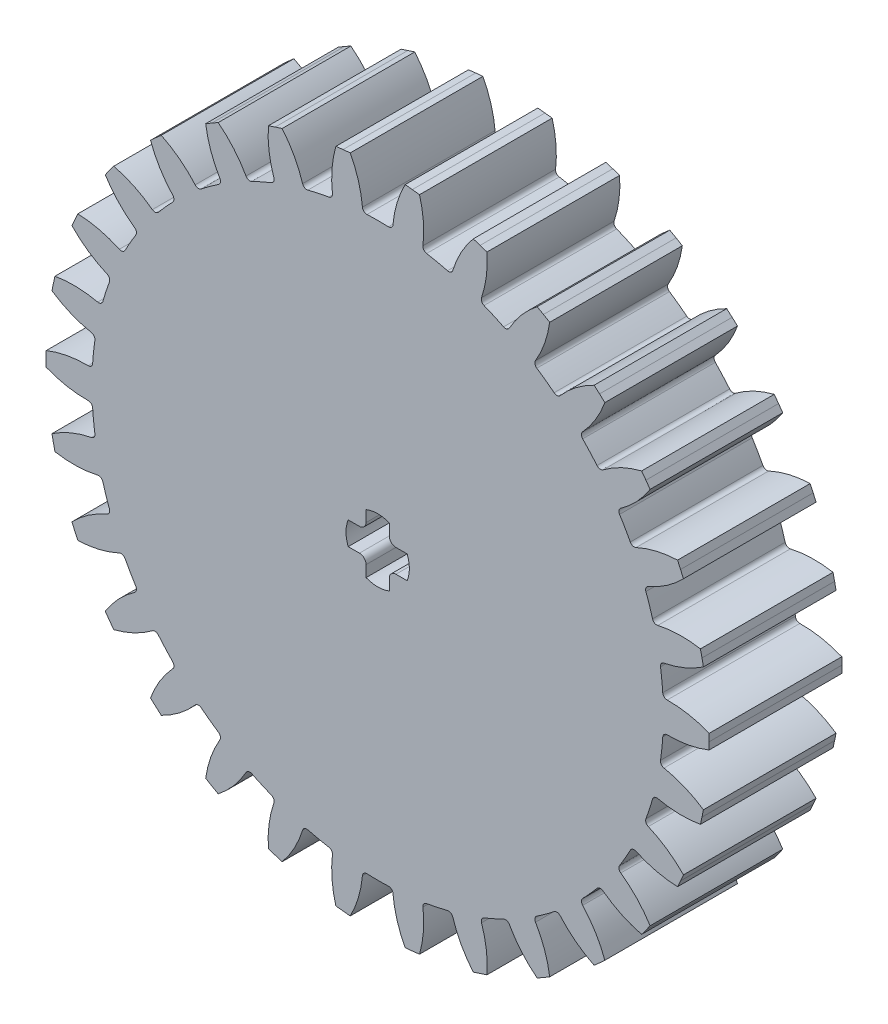
from build123d import *

# Parameters (mm, degrees)
BOSS_EXTRUDE1_DEPTH      = 10
FILLET1_R                = 0.3325
CIRPATTERN1_COUNT        = 30
FILLET1_OF_CIRPATTERN1_R = 0.3325
CUT_EXTRUDE1_REACH       = 38.684


with BuildPart() as part:
    # Sketch1 → Boss-Extrude1 (new body)
    with BuildSketch(Plane.XY):
        with BuildLine():
            Line((24.994050677, 0.545372126), (25, 0))
            Line((25, 0), (24.994050677, -0.545372126))
            ThreePointArc((24.994050677, -0.545372126), (23.285368719, -1.026917112), (21.512976752, -1.127447337))
            ThreePointArc((21.512976752, -1.127447337), (21.476091662, -1.69020507), (21.424487931, -2.25180442))
            Line((21.424487931, -2.25180442), (0, 0))
            Line((0, 0), (21.424487931, 2.25180442))
            ThreePointArc((21.424487931, 2.25180442), (21.476091662, 1.69020507), (21.512976752, 1.127447337))
            ThreePointArc((21.512976752, 1.127447337), (23.285368719, 1.026917112), (24.994050677, 0.545372126))
        make_face()
    boss_extrude1 = extrude(amount=BOSS_EXTRUDE1_DEPTH)

    # Fillet1
    fillet1_edges = [part.edges().sort_by_distance(p)[0] for p in [
        (21.512976752, 1.127447337, 5),
        (21.512976752, -1.127447337, 5),
    ]]
    fillet(fillet1_edges, radius=FILLET1_R)

    # CirPattern1: Boss-Extrude1 ×30 about axis
    cirpattern1_axis = Axis((0, 0, 0), (0, 0, 1))
    for i in range(1, CIRPATTERN1_COUNT):
        add(boss_extrude1.rotate(cirpattern1_axis, i * 360 / CIRPATTERN1_COUNT))

    # Fillet1 of CirPattern1
    fillet1_of_cirpattern1_edges = [part.edges().sort_by_distance(p)[0] for p in [
        (20.808457113, 5.575609279, 5),
        (21.277276077, 3.369989463, 5),
        (19.194508047, 9.780090341, 5),
        (20.111656338, 7.720141553, 5),
        (16.741666875, 13.557134524, 5),
        (18.06706071, 11.732886412, 5),
        (13.557134524, 16.741666875, 5),
        (15.232847834, 15.232847834, 5),
        (9.780090341, 19.194508047, 5),
        (11.732886412, 18.06706071, 5),
        (5.575609279, 20.808457113, 5),
        (7.720141553, 20.111656338, 5),
        (1.127447337, 21.512976752, 5),
        (3.369989463, 21.277276077, 5),
        (-3.369989463, 21.277276077, 5),
        (-1.127447337, 21.512976752, 5),
        (-7.720141553, 20.111656338, 5),
        (-5.575609279, 20.808457113, 5),
        (-11.732886412, 18.06706071, 5),
        (-9.780090341, 19.194508047, 5),
        (-15.232847834, 15.232847834, 5),
        (-13.557134524, 16.741666875, 5),
        (-18.06706071, 11.732886412, 5),
        (-16.741666875, 13.557134524, 5),
        (-20.111656338, 7.720141553, 5),
        (-19.194508047, 9.780090341, 5),
        (-21.277276077, 3.369989463, 5),
        (-20.808457113, 5.575609279, 5),
        (-21.512976752, -1.127447337, 5),
        (-21.512976752, 1.127447337, 5),
        (-20.808457113, -5.575609279, 5),
        (-21.277276077, -3.369989463, 5),
        (-19.194508047, -9.780090341, 5),
        (-20.111656338, -7.720141553, 5),
        (-16.741666875, -13.557134524, 5),
        (-18.06706071, -11.732886412, 5),
        (-13.557134524, -16.741666875, 5),
        (-15.232847834, -15.232847834, 5),
        (-9.780090341, -19.194508047, 5),
        (-11.732886412, -18.06706071, 5),
        (-5.575609279, -20.808457113, 5),
        (-7.720141553, -20.111656338, 5),
        (-1.127447337, -21.512976752, 5),
        (-3.369989463, -21.277276077, 5),
        (3.369989463, -21.277276077, 5),
        (1.127447337, -21.512976752, 5),
        (7.720141553, -20.111656338, 5),
        (5.575609279, -20.808457113, 5),
        (11.732886412, -18.06706071, 5),
        (9.780090341, -19.194508047, 5),
        (15.232847834, -15.232847834, 5),
        (13.557134524, -16.741666875, 5),
        (18.06706071, -11.732886412, 5),
        (16.741666875, -13.557134524, 5),
        (20.111656338, -7.720141553, 5),
        (19.194508047, -9.780090341, 5),
        (21.277276077, -3.369989463, 5),
        (20.808457113, -5.575609279, 5),
    ]]
    fillet(fillet1_of_cirpattern1_edges, radius=FILLET1_OF_CIRPATTERN1_R)

    # Sketch2 → Cut-Extrude1 (cut, up to next)
    with BuildSketch(Plane(origin=(0, 0, 0), x_dir=(-1, 0, 0), z_dir=(0, 0, -1)), mode=Mode.PRIVATE) as cut_extrude1_sk1:
        with BuildLine():
            Line((0.875, 2.22406722), (0.875, 1.375))
            ThreePointArc((0.875, 1.375), (1.021446609, 1.021446609), (1.375, 0.875))
            Line((1.375, 0.875), (2.22406722, 0.875))
            ThreePointArc((2.22406722, 0.875), (2.39, 0), (2.22406722, -0.875))
            Line((2.22406722, -0.875), (1.375, -0.875))
            ThreePointArc((1.375, -0.875), (1.021446609, -1.021446609), (0.875, -1.375))
            Line((0.875, -1.375), (0.875, -2.22406722))
            ThreePointArc((0.875, -2.22406722), (0, -2.39), (-0.875, -2.22406722))
            Line((-0.875, -2.22406722), (-0.875, -1.375))
            ThreePointArc((-0.875, -1.375), (-1.021446609, -1.021446609), (-1.375, -0.875))
            Line((-1.375, -0.875), (-2.22406722, -0.875))
            ThreePointArc((-2.22406722, -0.875), (-2.39, 0), (-2.22406722, 0.875))
            Line((-2.22406722, 0.875), (-1.375, 0.875))
            ThreePointArc((-1.375, 0.875), (-1.021446609, 1.021446609), (-0.875, 1.375))
            Line((-0.875, 1.375), (-0.875, 2.22406722))
            ThreePointArc((-0.875, 2.22406722), (0, 2.39), (0.875, 2.22406722))
        make_face()
    cut_extrude1_tool1 = extrude(cut_extrude1_sk1.sketch, amount=-CUT_EXTRUDE1_REACH, mode=Mode.PRIVATE) & part.part
    add(cut_extrude1_tool1.solids().sort_by_distance((0, 0, 0))[0], mode=Mode.SUBTRACT)


solid = part.part
